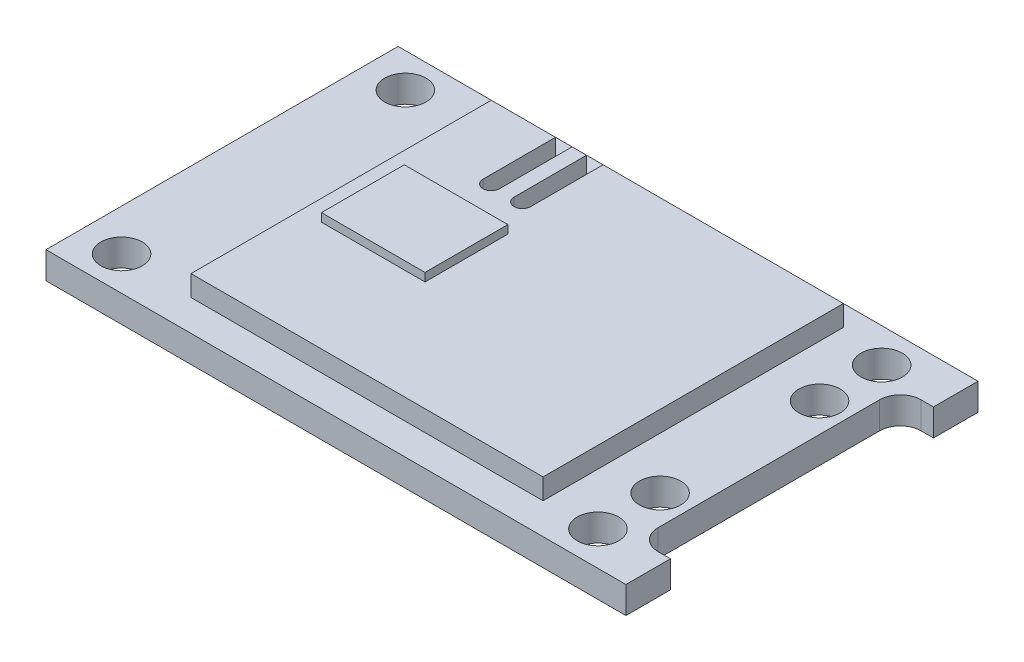
from build123d import *

# Parameters (mm, degrees)
EXTRUDE_1_DEPTH     = 1.3
SKETCH_2_R          = 1
CUT_EXTRUDE_1_DEPTH = 17.429850882
EXTRUDE_2_DEPTH     = 1
SKETCH_4_W          = 5
SKETCH_4_H          = 4
EXTRUDE_3_DEPTH     = 0.4


with BuildPart() as part:
    # Эскиз1 → Бобышка-Вытянуть1 (new body)
    with BuildSketch(Plane(origin=(0, 0, 0), x_dir=(1, 0, 0), z_dir=(0, 1, 0))):
        with BuildLine():
            Line((12.4, 5.35), (12.4, -5.35))
            ThreePointArc((12.4, -5.35), (12.692893219, -6.057106781), (13.4, -6.35))
            Line((13.4, -6.35), (14, -6.35))
            Line((14, -6.35), (14, -8.5))
            Line((14, -8.5), (-14, -8.5))
            Line((-14, -8.5), (-14, 8.5))
            Line((-14, 8.5), (14, 8.5))
            Line((14, 8.5), (14, 6.35))
            Line((14, 6.35), (13.4, 6.35))
            ThreePointArc((13.4, 6.35), (12.692893219, 6.057106781), (12.4, 5.35))
        make_face()
    extrude(amount=EXTRUDE_1_DEPTH)

    # Эскиз2 → Вырез-Вытянуть1 (cut, through all)
    with BuildSketch(Plane(origin=(0, 1.3, 0), x_dir=(1, 0, 0), z_dir=(0, 1, 0))):
        with Locations(Location((11, 6.85, 0), (0, 0, 270))):
            Circle(SKETCH_2_R)
        with Locations(Location((-12, 6.85, 0), (0, 0, 270))):
            Circle(SKETCH_2_R)
        with Locations(Location((-12, -6.85, 0), (0, 0, 270))):
            Circle(SKETCH_2_R)
        with Locations(Location((11, -6.85, 0), (0, 0, 270))):
            Circle(SKETCH_2_R)
        with Locations(Location((11, -3.85, 0), (0, 0, 270))):
            Circle(SKETCH_2_R)
        with Locations(Location((11, 3.85, 0), (0, 0, 270))):
            Circle(SKETCH_2_R)
    extrude(amount=-CUT_EXTRUDE_1_DEPTH, mode=Mode.SUBTRACT)

    # Эскиз3 → Бобышка-Вытянуть2 (add)
    with BuildSketch(Plane(origin=(0, 1.3, 0), x_dir=(1, 0, 0), z_dir=(0, 1, 0))):
        with BuildLine():
            Line((-5.4, 4), (-5.4, 7.5))
            Line((-5.4, 7.5), (-8.5, 7.5))
            Line((-8.5, 7.5), (-8.5, -7))
            Line((-8.5, -7), (8.5, -7))
            Line((8.5, -7), (8.5, 7.5))
            Line((8.5, 7.5), (-3.1, 7.5))
            Line((-3.1, 7.5), (-3.1, 4))
            ThreePointArc((-3.1, 4), (-3.5, 3.6), (-3.9, 4))
            Line((-3.9, 4), (-3.9, 7.5))
            Line((-3.9, 7.5), (-4.6, 7.5))
            Line((-4.6, 7.5), (-4.6, 4))
            ThreePointArc((-4.6, 4), (-5, 3.6), (-5.4, 4))
        make_face()
    extrude(amount=EXTRUDE_2_DEPTH)

    # Эскиз4 → Бобышка-Вытянуть3 (add)
    with BuildSketch(Plane(origin=(0, 2.3, 0), x_dir=(1, 0, 0), z_dir=(0, 1, 0))):
        with Locations((-5, 0.3)):
            Rectangle(SKETCH_4_W, SKETCH_4_H)
    extrude(amount=EXTRUDE_3_DEPTH)


solid = part.part
